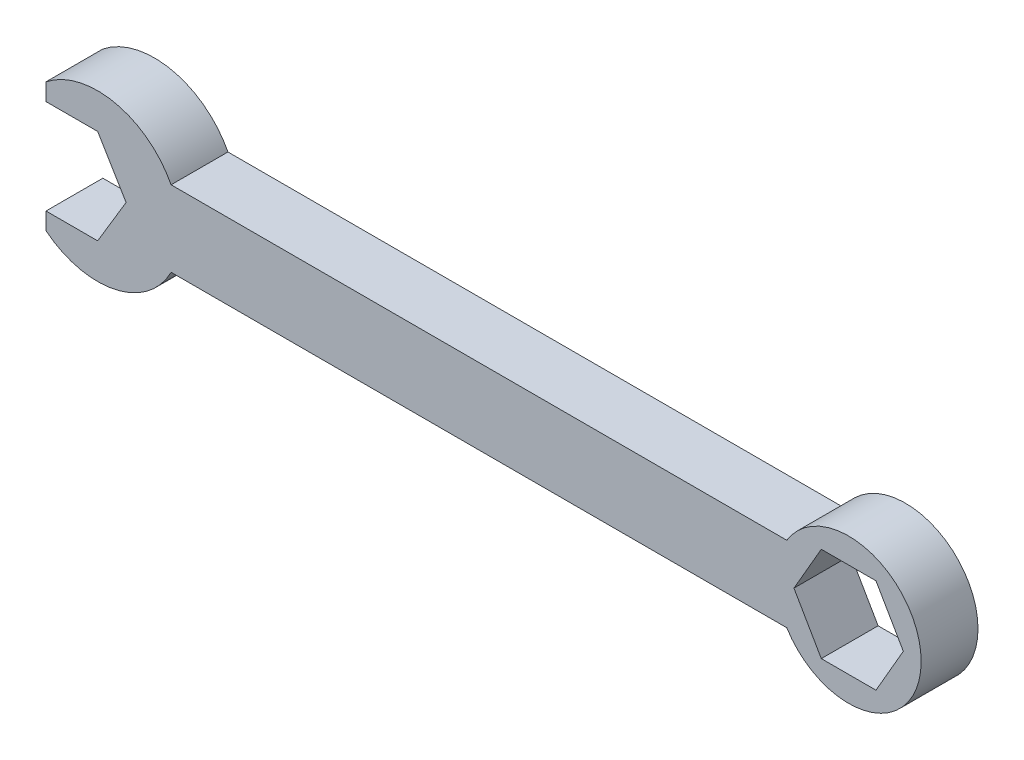
from build123d import *

# Parameters (mm, degrees)
SKETCH3_R           = 9.725108951
BOSS_EXTRUDE1_DEPTH = 7.62


with BuildPart() as part:
    # Sketch3 → Boss-Extrude1 (new body)
    # profile 1 of 3: a face of its own
    with BuildSketch(Plane.XY):
        with BuildLine():
            ThreePointArc((-107.617835055, -8.650731277), (-89.609901884, 0), (-107.617835055, 8.650731277))
            Line((-107.617835055, 8.650731277), (-107.617835055, 6.35))
            Line((-107.617835055, 6.35), (-100.691706912, 6.35))
            Line((-100.691706912, 6.35), (-96.881706912, 0))
            Line((-96.881706912, 0), (-100.691706912, -6.35))
            Line((-100.691706912, -6.35), (-107.617835055, -6.35))
            Line((-107.617835055, -6.35), (-107.617835055, -8.650731277))
        make_face()
    # profile 2 of 3: a face of its own
    with BuildSketch(Plane.XY):
        with BuildLine():
            ThreePointArc((-90.842848974, 5.08), (-89.609901884, 0), (-90.842848974, -5.08))
            Line((-90.842848974, -5.08), (-8.292848974, -5.08))
            ThreePointArc((-8.292848974, -5.08), (-9.725108951, 0), (-8.292848974, 5.08))
            Line((-8.292848974, 5.08), (-90.842848974, 5.08))
        make_face()
    # profile 3 of 3: a face of its own
    with BuildSketch(Plane.XY):
        Circle(SKETCH3_R)
        Polygon((3.666174209, -6.35), (7.332348419, 0), (3.666174209, 6.35), (-3.666174209, 6.35), (-7.332348419, 0), (-3.666174209, -6.35), align=None, mode=Mode.SUBTRACT)
    extrude(amount=BOSS_EXTRUDE1_DEPTH)


solid = part.part
